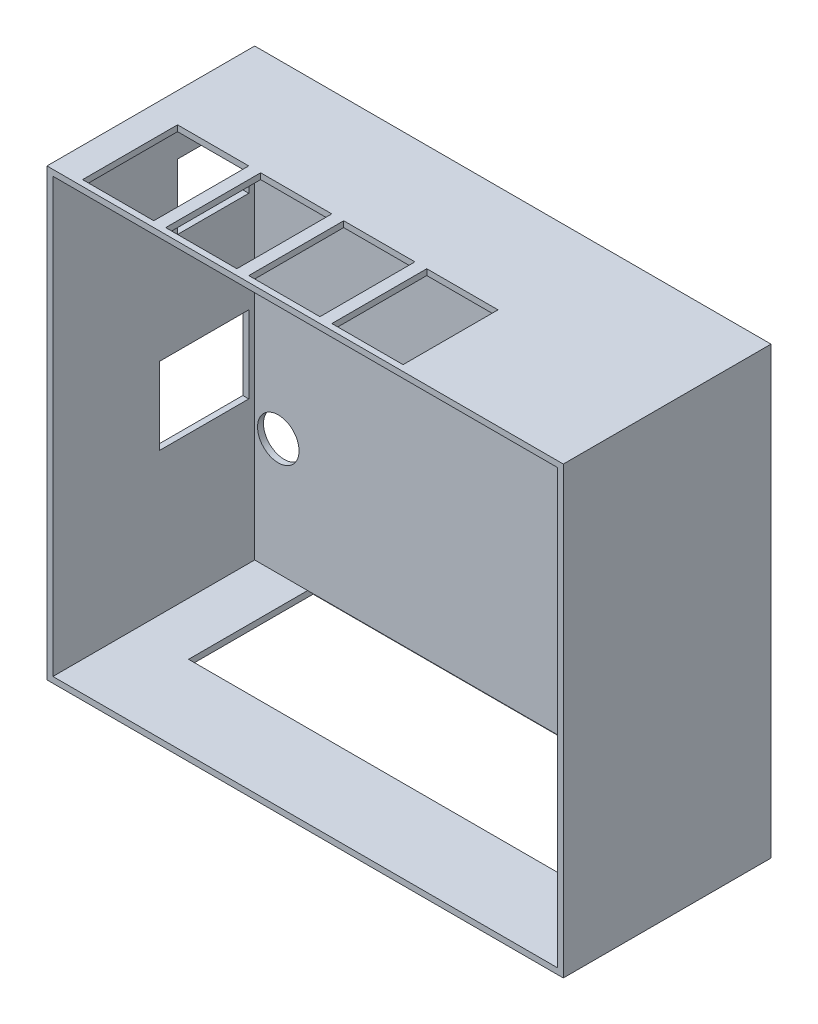
from build123d import *

# Parameters (mm, degrees)
ESQUISSE1_W              = 85
ESQUISSE1_H              = 73
BOSS_EXTRU_2_DEPTH       = 1
ESQUISSE6_W              = 35
ESQUISSE6_H              = 73
BOSS_EXTRU_4_DEPTH       = 1
ESQUISSE8_W              = 35
ESQUISSE8_H              = 73
BOSS_EXTRU_6_DEPTH       = 1
ESQUISSE10_W             = 12
ESQUISSE10_H             = 11
ENL_V_MAT_EXTRU_1_DEPTH  = 1
ESQUISSE11_W             = 15
ESQUISSE11_H             = 13
ENL_V_MAT_EXTRU_2_DEPTH  = 1
ESQUISSE13_W             = 87
ESQUISSE13_H             = 35
BOSS_EXTRU_8_DEPTH       = 1
ESQUISSE14_W             = 12
ESQUISSE14_H             = 16
ENL_V_MAT_EXTRU_3_DEPTH  = 1
ESQUISSE18_W             = 12
ESQUISSE18_H             = 16
ENL_V_MAT_EXTRU_5_DEPTH  = 1
ESQUISSE20_W             = 12
ESQUISSE20_H             = 16
ENL_V_MAT_EXTRU_6_DEPTH  = 1
ESQUISSE21_W             = 12
ESQUISSE21_H             = 16
ENL_V_MAT_EXTRU_7_DEPTH  = 1
ESQUISSE22_R             = 3.5
ENL_V_MAT_EXTRU_8_DEPTH  = 1
ESQUISSE24_R             = 3.5
ENL_V_MAT_EXTRU_10_DEPTH = 1
ESQUISSE25_W             = 87
ESQUISSE25_H             = 35
BOSS_EXTRU_11_DEPTH      = 1
ESQUISSE23_R             = 3.5
ENL_V_MAT_EXTRU_12_DEPTH = 1
ESQUISSE26_W             = 77
ESQUISSE26_H             = 21
ENL_V_MAT_EXTRU_13_DEPTH = 1


with BuildPart() as part:
    # Esquisse1 → Boss.-Extru.2 (new body)
    with BuildSketch(Plane.XY):
        with Locations((-89.704998798, 36.5)):
            Rectangle(ESQUISSE1_W, ESQUISSE1_H)
    extrude(amount=BOSS_EXTRU_2_DEPTH)

    # Esquisse6 → Boss.-Extru.4 (add)
    with BuildSketch(Plane(origin=(-47.204998798, 0, 0), x_dir=(0, 0, -1), z_dir=(1, 0, 0))):
        with Locations((-17.5, 36.5)):
            Rectangle(ESQUISSE6_W, ESQUISSE6_H)
    extrude(amount=BOSS_EXTRU_4_DEPTH)

    # Esquisse8 → Boss.-Extru.6 (add)
    with BuildSketch(Plane.ZY.offset(132.204998798)):
        with Locations((17.5, 36.5)):
            Rectangle(ESQUISSE8_W, ESQUISSE8_H)
    extrude(amount=BOSS_EXTRU_6_DEPTH)

    # Esquisse10 → Enlèv. mat.-Extru.1 (cut)
    with BuildSketch(Plane.ZY.offset(133.204998798)):
        with Locations((8, 59.5)):
            Rectangle(ESQUISSE10_W, ESQUISSE10_H)
    extrude(amount=-ENL_V_MAT_EXTRU_1_DEPTH, mode=Mode.SUBTRACT)

    # Esquisse11 → Enlèv. mat.-Extru.2 (cut)
    with BuildSketch(Plane.ZY.offset(133.204998798)):
        with Locations((9.5, 30.5)):
            Rectangle(ESQUISSE11_W, ESQUISSE11_H)
    extrude(amount=-ENL_V_MAT_EXTRU_2_DEPTH, mode=Mode.SUBTRACT)

    # Esquisse13 → Boss.-Extru.8 (add)
    with BuildSketch(Plane(origin=(0, 73, 0), x_dir=(1, 0, 0), z_dir=(0, 1, 0))):
        with Locations((-89.704998798, -17.5)):
            Rectangle(ESQUISSE13_W, ESQUISSE13_H)
    extrude(amount=BOSS_EXTRU_8_DEPTH)

    # Esquisse14 → Enlèv. mat.-Extru.3 (cut)
    with BuildSketch(Plane(origin=(0, 74, 0), x_dir=(1, 0, 0), z_dir=(0, 1, 0))):
        with Locations((-122.207040337, -26)):
            Rectangle(ESQUISSE14_W, ESQUISSE14_H)
    extrude(amount=-ENL_V_MAT_EXTRU_3_DEPTH, mode=Mode.SUBTRACT)

    # Esquisse18 → Enlèv. mat.-Extru.5 (cut)
    with BuildSketch(Plane(origin=(0, 74, 0), x_dir=(1, 0, 0), z_dir=(0, 1, 0))):
        with Locations((-108.207040337, -26)):
            Rectangle(ESQUISSE18_W, ESQUISSE18_H)
    extrude(amount=-ENL_V_MAT_EXTRU_5_DEPTH, mode=Mode.SUBTRACT)

    # Esquisse20 → Enlèv. mat.-Extru.6 (cut)
    with BuildSketch(Plane(origin=(0, 74, 0), x_dir=(1, 0, 0), z_dir=(0, 1, 0))):
        with Locations((-94.207040337, -26)):
            Rectangle(ESQUISSE20_W, ESQUISSE20_H)
    extrude(amount=-ENL_V_MAT_EXTRU_6_DEPTH, mode=Mode.SUBTRACT)

    # Esquisse21 → Enlèv. mat.-Extru.7 (cut)
    with BuildSketch(Plane(origin=(0, 74, 0), x_dir=(1, 0, 0), z_dir=(0, 1, 0))):
        with Locations((-80.207040337, -26)):
            Rectangle(ESQUISSE21_W, ESQUISSE21_H)
    extrude(amount=-ENL_V_MAT_EXTRU_7_DEPTH, mode=Mode.SUBTRACT)

    # Esquisse22 → Enlèv. mat.-Extru.8 (cut)
    with BuildSketch(Plane.XY.offset(1)):
        with Locations((-128.334603856, 69.17039525)):
            Circle(ESQUISSE22_R)
    extrude(amount=-ENL_V_MAT_EXTRU_8_DEPTH, mode=Mode.SUBTRACT)

    # Esquisse24 → Enlèv. mat.-Extru.10 (cut)
    with BuildSketch(Plane.XY.offset(1)):
        with Locations((-69.71638406, 68.525894508)):
            Circle(ESQUISSE24_R)
    extrude(amount=-ENL_V_MAT_EXTRU_10_DEPTH, mode=Mode.SUBTRACT)

    # Esquisse25 → Boss.-Extru.11 (add)
    with BuildSketch(Plane.XZ):
        with Locations((-89.704998798, 17.5)):
            Rectangle(ESQUISSE25_W, ESQUISSE25_H)
    extrude(amount=BOSS_EXTRU_11_DEPTH)

    # Esquisse23 → Enlèv. mat.-Extru.12 (cut)
    with BuildSketch(Plane.XY.offset(1)):
        with Locations((-128.228777758, 19.66052326)):
            Circle(ESQUISSE23_R)
    extrude(amount=-ENL_V_MAT_EXTRU_12_DEPTH, mode=Mode.SUBTRACT)

    # Esquisse26 → Enlèv. mat.-Extru.13 (cut)
    with BuildSketch(Plane.XZ.offset(1)):
        with Locations((-84.785991567, 10.567106243)):
            Rectangle(ESQUISSE26_W, ESQUISSE26_H)
    extrude(amount=-ENL_V_MAT_EXTRU_13_DEPTH, mode=Mode.SUBTRACT)


solid = part.part
